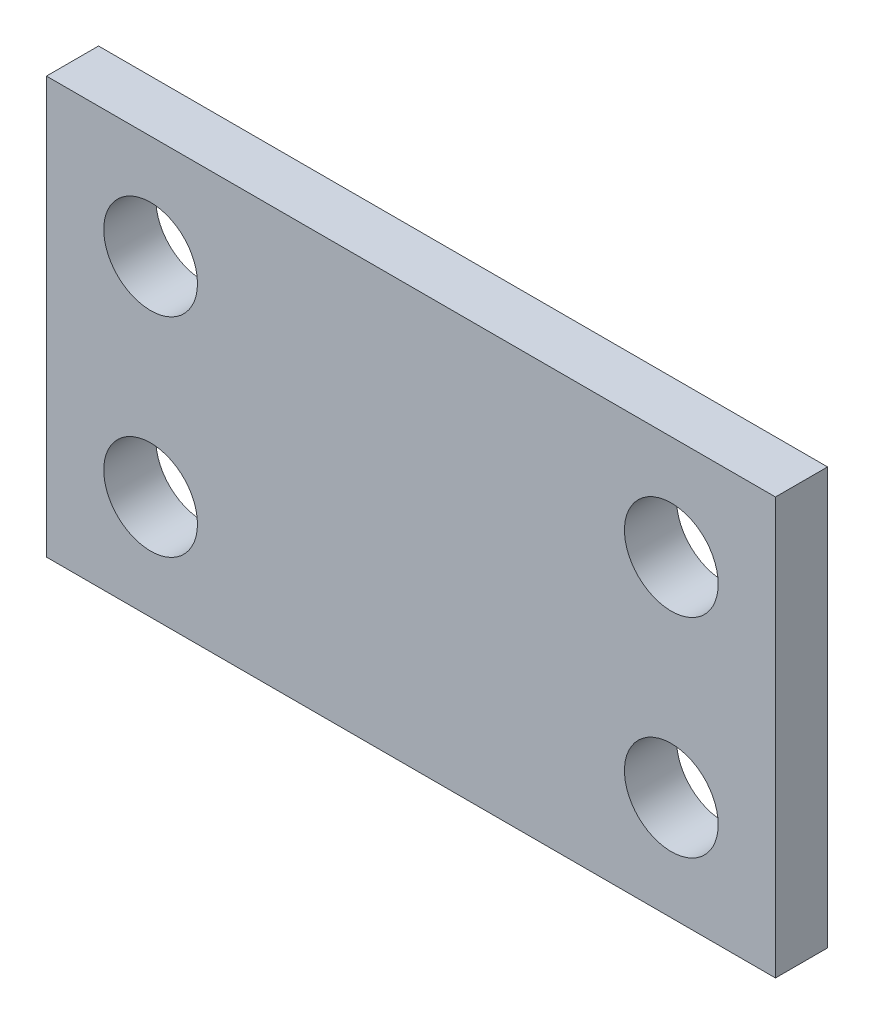
from build123d import *

# Parameters (mm, degrees)
SZKIC1_W                    = 140
SZKIC1_H                    = 80
SZKIC1_R                    = 9
DODANIE_WYCI_GNI_CIE1_DEPTH = 10


with BuildPart() as part:
    # Szkic1 → Dodanie-wyciągnięcie1 (new body)
    with BuildSketch(Plane.XY):
        Rectangle(SZKIC1_W, SZKIC1_H)
        with Locations((50, 20)):
            Circle(SZKIC1_R, mode=Mode.SUBTRACT)
        with Locations((-50, 20)):
            Circle(SZKIC1_R, mode=Mode.SUBTRACT)
        with Locations((-50, -20)):
            Circle(SZKIC1_R, mode=Mode.SUBTRACT)
        with Locations((50, -20)):
            Circle(SZKIC1_R, mode=Mode.SUBTRACT)
    extrude(amount=DODANIE_WYCI_GNI_CIE1_DEPTH)


solid = part.part
